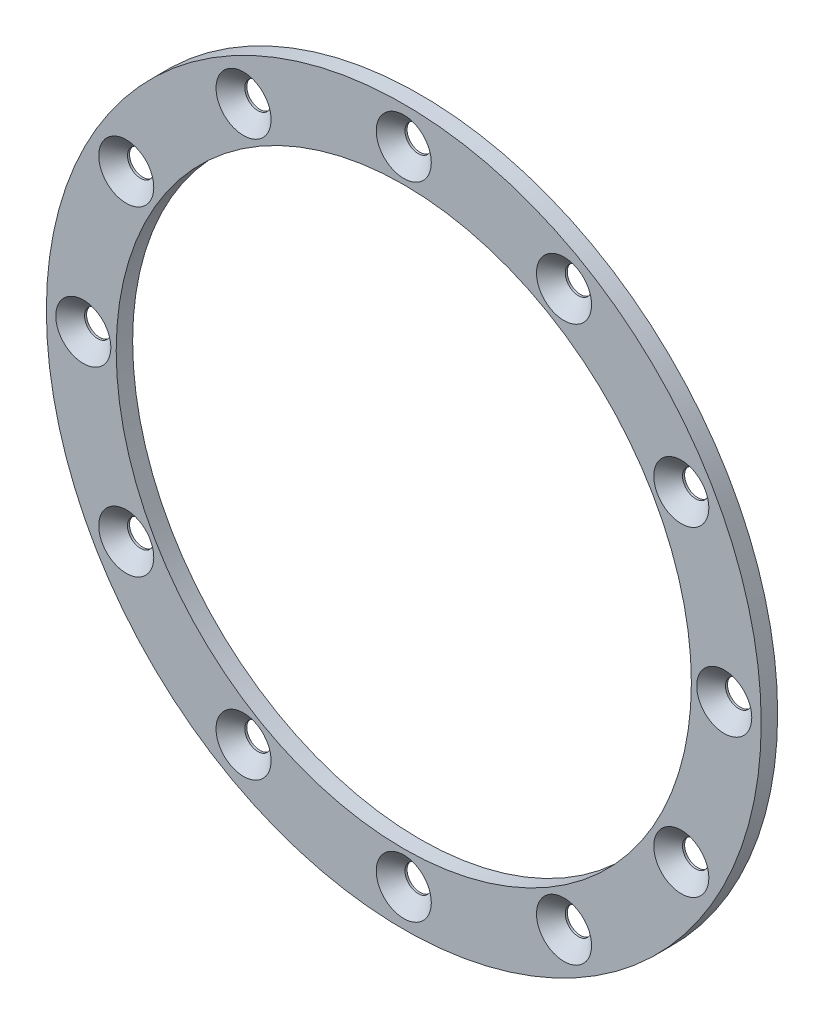
from build123d import *

# Parameters (mm, degrees)
SKETCH1_R           = 43.5
SKETCH1_R_2         = 35
BOSS_EXTRUDE1_DEPTH = 2
SKETCH2_R           = 1.5
CUT_EXTRUDE1_DEPTH  = 10
CIRPATTERN1_COUNT   = 12
CIRPATTERN2_COUNT   = 12


with BuildPart() as part:
    # Sketch1 → Boss-Extrude1 (new body)
    with BuildSketch(Plane.XY):
        Circle(SKETCH1_R)
        Circle(SKETCH1_R_2, mode=Mode.SUBTRACT)
    extrude(amount=BOSS_EXTRUDE1_DEPTH)

    # Sketch2 → Cut-Extrude1 (cut)
    with BuildSketch(Plane.XY.offset(2)):
        with Locations((0, 39)):
            Circle(SKETCH2_R)
    cut_extrude1 = extrude(amount=-CUT_EXTRUDE1_DEPTH, mode=Mode.SUBTRACT)

    # CirPattern1: Cut-Extrude1 ×12 about axis
    cirpattern1_axis = Axis((0, 0, 0), (0, 0, 1))
    for i in range(1, CIRPATTERN1_COUNT):
        add(cut_extrude1.rotate(cirpattern1_axis, i * 360 / CIRPATTERN1_COUNT), mode=Mode.SUBTRACT)

    # Sketch4 → CSK for M3 Flat Head Machine Screw1 (revolve, cut)
    with BuildSketch(Plane(origin=(0, 39, 2), x_dir=(0, -1, 0), z_dir=(1, 0, 0))):
        Polygon((0, 0), (0, 2), (1.6, 2), (1.6, 1.75), (3.35, 0), align=None)
    csk_for_m3_flat_head_machine_screw1 = revolve(axis=Axis((0, 39, 8.35), (0, 0, -1)), mode=Mode.SUBTRACT)

    # CirPattern2: CSK for M3 Flat Head Machine Screw1 ×12 about axis
    cirpattern2_axis = Axis((0, 0, 0), (0, 0, 1))
    for i in range(1, CIRPATTERN2_COUNT):
        add(csk_for_m3_flat_head_machine_screw1.rotate(cirpattern2_axis, i * 360 / CIRPATTERN2_COUNT), mode=Mode.SUBTRACT)


solid = part.part
